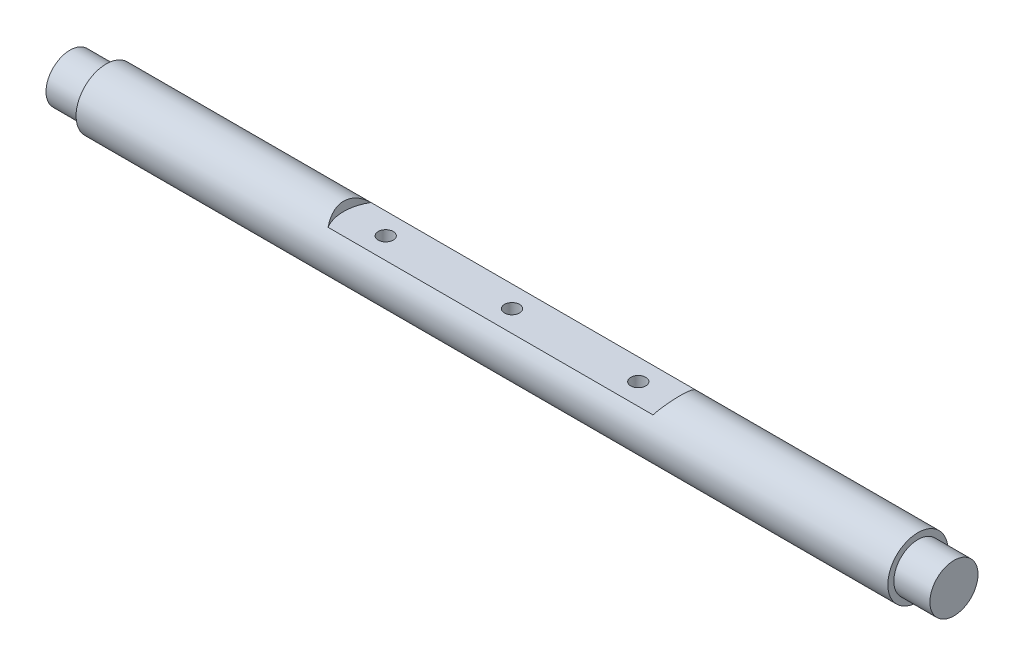
from build123d import *

# Parameters (mm, degrees)
ENL_V_MAT_EXTRU_1_DEPTH      = 74.839352652
ENL_V_MAT_EXTRU_1_DEPTH_BACK = 74.839352652
ESQUISSE2_R                  = 1.25
ENL_V_START                  = 3.5
ENL_V_MAT_EXTRU_2_DEPTH      = 10


with BuildPart() as part:
    # Esquisse1 → Révolution1 (revolve)
    with BuildSketch(Plane.XY):
        Polygon((-67.5, 5), (67.5, 5), (67.5, 4), (73.5, 4), (73.5, 0), (-73.5, 0), (-73.5, 4), (-67.5, 4), align=None)
    revolve(axis=Axis((-73.5, 0, 0), (-1, 0, 0)))

    # Esquisse2 → Enlèv. mat.-Extru.1 (cut, two sides: drawn at the far end of the back side and taken through both)
    with BuildSketch(Plane(origin=(0, 0, 0), x_dir=(1, 0, 0), z_dir=(0, 1, 0)).offset(-ENL_V_MAT_EXTRU_1_DEPTH_BACK)):
        with Locations(Location((-21, 0, 0), (0, 0, 270))):
            Circle(ESQUISSE2_R)
        with Locations(Location((21, 0, 0), (0, 0, 270))):
            Circle(ESQUISSE2_R)
        with Locations(Location((0, 0, 0), (0, 0, 270))):
            Circle(ESQUISSE2_R)
    extrude(amount=ENL_V_MAT_EXTRU_1_DEPTH + ENL_V_MAT_EXTRU_1_DEPTH_BACK, mode=Mode.SUBTRACT)

    # Esquisse3 → Enlèv. mat.-Extru.2 (cut)
    with BuildSketch(Plane(origin=(0, 0, 0), x_dir=(1, 0, 0), z_dir=(0, 1, 0)).offset(ENL_V_START)):
        with BuildLine():
            Line((-21, 7), (21, 7))
            ThreePointArc((21, 7), (28, 0), (21, -7))
            Line((21, -7), (-21, -7))
            ThreePointArc((-21, -7), (-28, 0), (-21, 7))
        make_face()
    extrude(amount=ENL_V_MAT_EXTRU_2_DEPTH, mode=Mode.SUBTRACT)


solid = part.part
